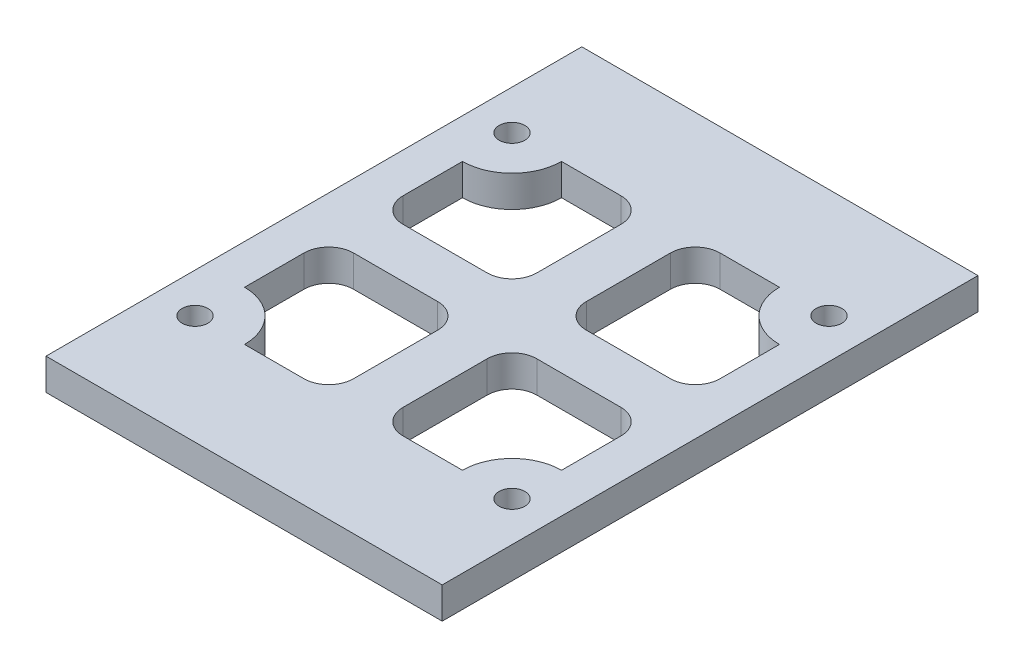
from build123d import *

# Parameters (mm, degrees)
SKETCH1_W           = 80
SKETCH1_H           = 108.18
SKETCH1_R           = 2.6
BOSS_EXTRUDE1_DEPTH = 6.35
CUT_EXTRUDE1_DEPTH  = 6.35


with BuildPart() as part:
    # Sketch1 → Boss-Extrude1 (new body)
    with BuildSketch(Plane(origin=(0, 0, 0), x_dir=(1, 0, 0), z_dir=(0, 1, 0))):
        Rectangle(SKETCH1_W, SKETCH1_H)
        with Locations(Location((-32, 32, 0), (0, 0, 270))):
            Circle(SKETCH1_R, mode=Mode.SUBTRACT)
        with Locations(Location((32, 32, 0), (0, 0, 270))):
            Circle(SKETCH1_R, mode=Mode.SUBTRACT)
        with Locations(Location((32, -32, 0), (0, 0, 270))):
            Circle(SKETCH1_R, mode=Mode.SUBTRACT)
        with Locations(Location((-32, -32, 0), (0, 0, 270))):
            Circle(SKETCH1_R, mode=Mode.SUBTRACT)
    extrude(amount=BOSS_EXTRUDE1_DEPTH)

    # Sketch2 → Cut-Extrude1 (cut)
    with BuildSketch(Plane(origin=(0, 6.35, 0), x_dir=(1, 0, 0), z_dir=(0, 1, 0))):
        with BuildLine():
            Line((-27, -5), (-10, -5))
            ThreePointArc((-10, -5), (-6.464466094, -6.464466094), (-5, -10))
            Line((-5, -10), (-5, -27))
            ThreePointArc((-5, -27), (-6.464466094, -30.535533906), (-10, -32))
            Line((-10, -32), (-22, -32))
            ThreePointArc((-22, -32), (-24.928932188, -24.928932188), (-32, -22))
            Line((-32, -22), (-32, -10))
            ThreePointArc((-32, -10), (-30.535533906, -6.464466094), (-27, -5))
        make_face()
        with BuildLine():
            Line((-22, 32), (-10, 32))
            ThreePointArc((-10, 32), (-6.464466094, 30.535533906), (-5, 27))
            Line((-5, 27), (-5, 10))
            ThreePointArc((-5, 10), (-6.464466094, 6.464466094), (-10, 5))
            Line((-10, 5), (-27, 5))
            ThreePointArc((-27, 5), (-30.535533906, 6.464466094), (-32, 10))
            Line((-32, 10), (-32, 22))
            ThreePointArc((-32, 22), (-24.928932188, 24.928932188), (-22, 32))
        make_face()
        with BuildLine():
            Line((32, 22), (32, 10))
            ThreePointArc((32, 10), (30.535533906, 6.464466094), (27, 5))
            Line((27, 5), (10, 5))
            ThreePointArc((10, 5), (6.464466094, 6.464466094), (5, 10))
            Line((5, 10), (5, 27))
            ThreePointArc((5, 27), (6.464466094, 30.535533906), (10, 32))
            Line((10, 32), (22, 32))
            ThreePointArc((22, 32), (24.928932188, 24.928932188), (32, 22))
        make_face()
        with BuildLine():
            Line((22, -32), (10, -32))
            ThreePointArc((10, -32), (6.464466094, -30.535533906), (5, -27))
            Line((5, -27), (5, -10))
            ThreePointArc((5, -10), (6.464466094, -6.464466094), (10, -5))
            Line((10, -5), (27, -5))
            ThreePointArc((27, -5), (30.535533906, -6.464466094), (32, -10))
            Line((32, -10), (32, -22))
            ThreePointArc((32, -22), (24.928932188, -24.928932188), (22, -32))
        make_face()
    extrude(amount=-CUT_EXTRUDE1_DEPTH, mode=Mode.SUBTRACT)


solid = part.part
